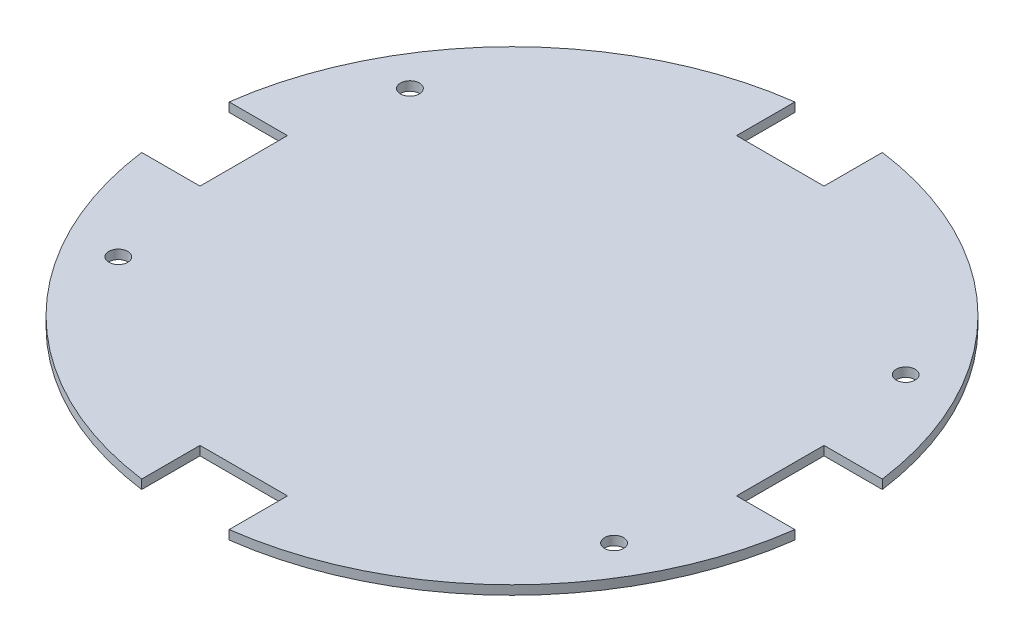
from build123d import *

# Parameters (mm, degrees)
SKETCH1_R           = 1.651
BOSS_EXTRUDE1_DEPTH = 1.5875


with BuildPart() as part:
    # Sketch1 → Boss-Extrude1 (new body)
    with BuildSketch(Plane(origin=(0, 0, 0), x_dir=(1, 0, 0), z_dir=(0, 1, 0))):
        with BuildLine():
            Line((-7.62, 56.896), (-7.62, 46.736))
            Line((-7.62, 46.736), (7.62, 46.736))
            Line((7.62, 46.736), (7.62, 56.896))
            ThreePointArc((7.62, 56.896), (40.590757667, 40.590757667), (56.896, 7.62))
            Line((56.896, 7.62), (46.736, 7.62))
            Line((46.736, 7.62), (46.736, -7.62))
            Line((46.736, -7.62), (56.896, -7.62))
            ThreePointArc((56.896, -7.62), (40.590757667, -40.590757667), (7.62, -56.896))
            Line((7.62, -56.896), (7.62, -46.736))
            Line((7.62, -46.736), (-7.62, -46.736))
            Line((-7.62, -46.736), (-7.62, -56.896))
            ThreePointArc((-7.62, -56.896), (-40.590757667, -40.590757667), (-56.896, -7.62))
            Line((-56.896, -7.62), (-46.736, -7.62))
            Line((-46.736, -7.62), (-46.736, 7.62))
            Line((-46.736, 7.62), (-56.896, 7.62))
            ThreePointArc((-56.896, 7.62), (-40.590757667, 40.590757667), (-7.62, 56.896))
        make_face()
        with Locations(Location((-43.18, 25.4, 0), (0, 0, 270))):
            Circle(SKETCH1_R, mode=Mode.SUBTRACT)
        with Locations(Location((-43.18, -25.4, 0), (0, 0, 270))):
            Circle(SKETCH1_R, mode=Mode.SUBTRACT)
        with Locations(Location((43.18, -25.4, 0), (0, 0, 270))):
            Circle(SKETCH1_R, mode=Mode.SUBTRACT)
        with Locations(Location((43.18, 25.4, 0), (0, 0, 270))):
            Circle(SKETCH1_R, mode=Mode.SUBTRACT)
    extrude(amount=BOSS_EXTRUDE1_DEPTH)


solid = part.part
